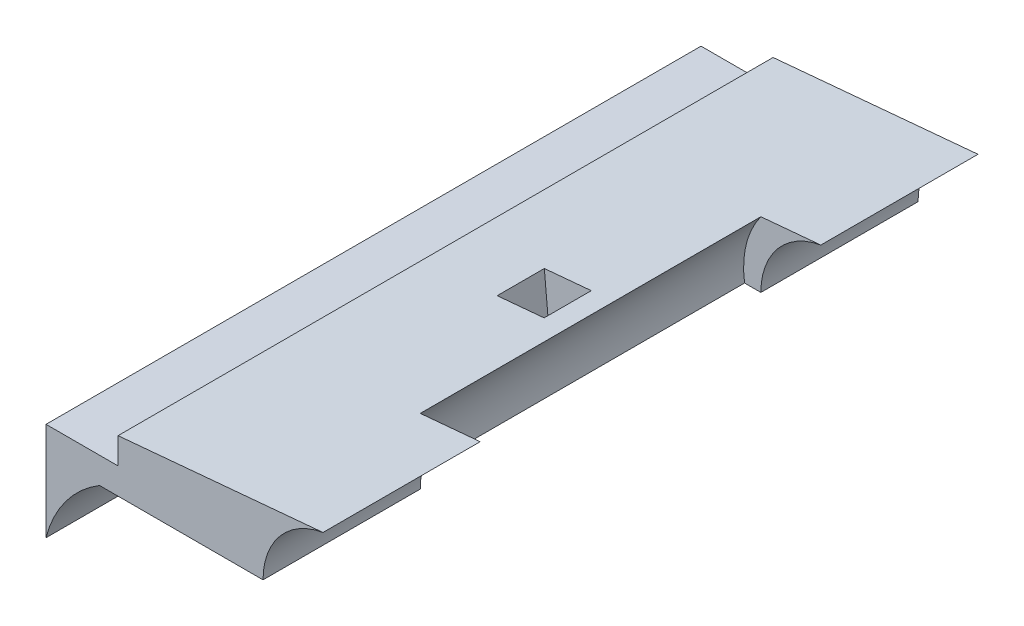
from build123d import *

# Parameters (mm, degrees)
SALIENTE_EXTRUIR1_DEPTH     = 100
CORTAR_EXTRUIR2_DEPTH       = 26
CORTAR_EXTRUIR2_DEPTH_BACK  = 26
CROQUIS3_R                  = 13.5
CROQUIS11_W                 = 7.2
CROQUIS11_H                 = 7.2
CORTAR_EXTRUIR6_DEPTH       = 6
CROQUIS12_W                 = 5.5
CROQUIS12_H                 = 5.5
CORTAR_EXTRUIR7_DEPTH       = 6
CORTAR_EXTRUIR11_DEPTH      = 110.476024773
CORTAR_EXTRUIR11_DEPTH_BACK = 110.476024773
SALIENTE_EXTRUIR2_DEPTH     = 100


with BuildPart() as part:
    # Croquis1 → Saliente-Extruir1 (new body)
    with BuildSketch(Plane.XY):
        with BuildLine():
            Line((0, 0), (11, 0))
            Line((11, 0), (11, 4))
            Line((11, 4), (44, 7))
            Line((44, 7), (44, 4))
            ThreePointArc((44, 4), (39.101020514, 1.464101615), (38.343145751, -4))
            Line((38.343145751, -4), (0, -4))
            Line((0, -4), (0, 0))
        make_face()
    extrude(amount=SALIENTE_EXTRUIR1_DEPTH)

    # Croquis3 → Cortar-Extruir2 (cut, two sides: drawn at the far end of the back side and taken through both)
    with BuildSketch(Plane.XY.offset(50).offset(-CORTAR_EXTRUIR2_DEPTH_BACK)):
        with Locations((44, -2)):
            Circle(CROQUIS3_R)
    extrude(amount=CORTAR_EXTRUIR2_DEPTH + CORTAR_EXTRUIR2_DEPTH_BACK, mode=Mode.SUBTRACT)

    # Croquis11 → Cortar-Extruir6 (cut)
    with BuildSketch(Plane(origin=(-0.270491803, 2.975409836, 0), x_dir=(0.995893206467704, 0.09053574604251857, 0), z_dir=(-0.09053574604251857, 0.995893206467704, 0))):
        with Locations((26.442986434, -50)):
            Rectangle(CROQUIS11_W, CROQUIS11_H)
    extrude(amount=-CORTAR_EXTRUIR6_DEPTH, mode=Mode.SUBTRACT)

    # Croquis12 → Cortar-Extruir7 (cut)
    with BuildSketch(Plane(origin=(0.272722673, -2.999949403, 0), x_dir=(0.995893206467704, 0.09053574604251854, 0), z_dir=(-0.09053574604251854, 0.995893206467704, 0))):
        with Locations((26.442986434, -50)):
            Rectangle(CROQUIS12_W, CROQUIS12_H)
    extrude(amount=-CORTAR_EXTRUIR7_DEPTH, mode=Mode.SUBTRACT)

    # Croquis14 → Cortar-Extruir11 (cut, two sides: drawn at the far end of the back side and taken through both)
    with BuildSketch(Plane.XY.offset(100).offset(-CORTAR_EXTRUIR11_DEPTH_BACK)):
        with BuildLine():
            Line((33.134740511, -104.708323764), (33.134740511, -4))
            ThreePointArc((33.134740511, -4), (36.309024056, 3.730683407), (44, 7))
            Line((44, 7), (144.700675445, 8.241144726))
            Line((144.700675445, 8.241144726), (287.998687156, -133.301589954))
            Line((287.998687156, -133.301589954), (176.432752222, -246.251058444))
            Line((176.432752222, -246.251058444), (33.134740511, -104.708323764))
        make_face()
    extrude(amount=CORTAR_EXTRUIR11_DEPTH + CORTAR_EXTRUIR11_DEPTH_BACK, mode=Mode.SUBTRACT)

    # Croquis15 → Saliente-Extruir2 (add)
    with BuildSketch(Plane.XY.offset(100)):
        with BuildLine():
            Line((0, -4), (0, -15))
            ThreePointArc((0, -15), (3.001359468, -8.695211228), (8.169871019, -4))
            Line((8.169871019, -4), (0, -4))
        make_face()
    extrude(amount=-SALIENTE_EXTRUIR2_DEPTH)


solid = part.part
